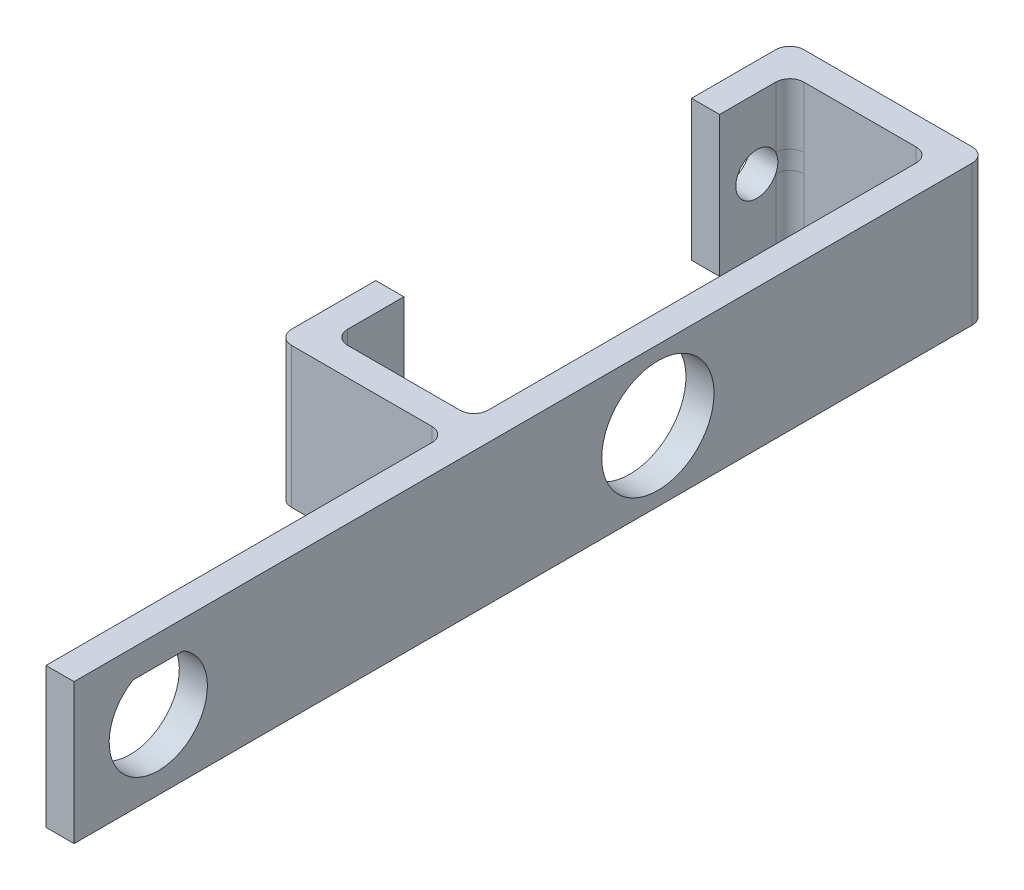
from build123d import *

# Parameters (mm, degrees)
BOSS_EXTRUDE1_DEPTH = 10
SKETCH2_R           = 1.5
CUT_EXTRUDE1_DEPTH  = 2
SKETCH3_R           = 4
CUT_EXTRUDE2_DEPTH  = 2
FILLET1_R           = 1


with BuildPart() as part:
    # Sketch1 → Boss-Extrude1 (new body)
    with BuildSketch(Plane(origin=(0, 0, 0), x_dir=(1, 0, 0), z_dir=(0, 1, 0))):
        Polygon((12, 5), (12, -27.5), (2, -27.5), (2, -22.5), (0, -22.5), (0, -29.5), (12, -29.5), (12, -58), (14, -58), (14, 7), (0, 7), (0, 0), (2, 0), (2, 5), align=None)
    extrude(amount=BOSS_EXTRUDE1_DEPTH)

    # Sketch2 → Cut-Extrude1 (cut)
    with BuildSketch(Plane.ZY):
        with Locations((25.15, 5)):
            Circle(SKETCH2_R)
        with Locations((-2.65, 5)):
            Circle(SKETCH2_R)
    extrude(amount=-CUT_EXTRUDE1_DEPTH, mode=Mode.SUBTRACT)

    # Sketch3 → Cut-Extrude2 (cut)
    with BuildSketch(Plane.ZY.offset(-12)):
        with Locations((16.4, 5)):
            Circle(SKETCH3_R)
        with BuildLine():
            Line((50.197224362, 8), (53.802775638, 8))
            ThreePointArc((53.802775638, 8), (52, 1.5), (50.197224362, 8))
        make_face()
    extrude(amount=-CUT_EXTRUDE2_DEPTH, mode=Mode.SUBTRACT)

    # Fillet1
    fillet1_edges = [part.edges().sort_by_distance(p)[0] for p in [
        (2, 5, 27.5),
        (12, 5, 27.5),
        (12, 5, -5),
        (2, 5, -5),
        (0, 5, -7),
        (14, 5, -7),
        (12, 5, 29.5),
        (0, 5, 29.5),
    ]]
    fillet(fillet1_edges, radius=FILLET1_R)


solid = part.part
